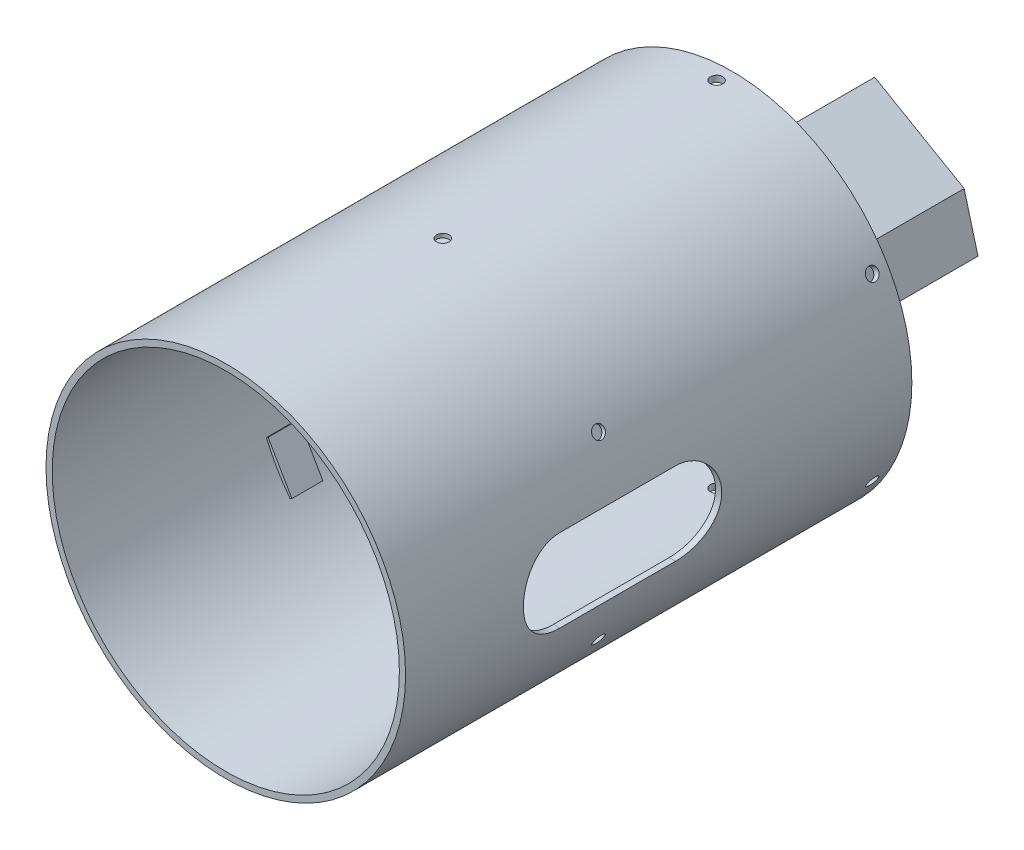
from build123d import *

# Parameters (mm, degrees)
SZKIC1_R                    = 87
SZKIC1_R_2                  = 84
DODANIE_WYCI_GNI_CIE1_DEPTH = 245
SZKIC3_R                    = 3
WYTNIJ_WYCI_GNI_CIE1_DEPTH  = 245
SZYK_KO_OWY1_COUNT          = 6
SZKIC5_W                    = 23.002883638
SZKIC5_H                    = 15
DODANIE_WYCI_GNI_CIE2_DEPTH = 85
SZYK_KO_OWY2_COUNT          = 6
WYTNIJ_WYCI_GNI_CIE2_DEPTH  = 245
WYTNIJ_WYCI_GNI_CIE3_DEPTH  = 130
DODANIE_WYCI_GNI_CIE3_DEPTH = 69


with BuildPart() as part:
    # Szkic1 → Dodanie-wyciągnięcie1 (new body)
    with BuildSketch(Plane.XY):
        Circle(SZKIC1_R)
        Circle(SZKIC1_R_2, mode=Mode.SUBTRACT)
    extrude(amount=DODANIE_WYCI_GNI_CIE1_DEPTH)

    # Szkic3 → Wytnij-wyciągnięcie1 (cut)
    with BuildSketch(Plane(origin=(0, 0, 0), x_dir=(1, 0, 0), z_dir=(0, 1, 0))):
        with Locations(Location((0, -140, 0), (0, 0, 270))):
            Circle(SZKIC3_R)
        with Locations(Location((0, -7.5, 0), (0, 0, 270))):
            Circle(SZKIC3_R)
    wytnij_wyci_gni_cie1 = extrude(amount=-WYTNIJ_WYCI_GNI_CIE1_DEPTH, mode=Mode.SUBTRACT)

    # Szyk kołowy1: Wytnij-wyciągnięcie1 ×6 about axis
    szyk_ko_owy1_axis = Axis((0, 0, 0), (0, 0, 1))
    for i in range(1, SZYK_KO_OWY1_COUNT):
        add(wytnij_wyci_gni_cie1.rotate(szyk_ko_owy1_axis, i * 360 / SZYK_KO_OWY1_COUNT), mode=Mode.SUBTRACT)

    # Szkic5 → Dodanie-wyciągnięcie2 (add)
    with BuildSketch(Plane(origin=(0, 0, 0), x_dir=(1, 0, 0), z_dir=(0, 1, 0))):
        with Locations((0, -140)):
            Rectangle(SZKIC5_W, SZKIC5_H)
    dodanie_wyci_gni_cie2 = extrude(amount=DODANIE_WYCI_GNI_CIE2_DEPTH)

    # Szyk kołowy2: Dodanie-wyciągnięcie2 ×6 about axis
    szyk_ko_owy2_axis = Axis((0, 0, 0), (0, 0, 1))
    for i in range(1, SZYK_KO_OWY2_COUNT):
        add(dodanie_wyci_gni_cie2.rotate(szyk_ko_owy2_axis, i * 360 / SZYK_KO_OWY2_COUNT))

    # Szkic6 → Wytnij-wyciągnięcie2 (cut)
    with BuildSketch(Plane(origin=(0, 0, 0), x_dir=(-1, 0, 0), z_dir=(0, 0, -1))):
        Polygon((-12.5, 82.3), (12.5, 82.3), (65.023890731, 51.975317547), (77.523890731, 30.324682453), (77.523890731, -30.324682453), (65.023890731, -51.975317547), (12.5, -82.3), (-12.5, -82.3), (-65.023890731, -51.975317547), (-77.523890731, -30.324682453), (-77.523890731, 30.324682453), (-65.023890731, 51.975317547), align=None)
    extrude(amount=-WYTNIJ_WYCI_GNI_CIE2_DEPTH, mode=Mode.SUBTRACT)

    # Szkic7 → Wytnij-wyciągnięcie3 (cut)
    with BuildSketch(Plane(origin=(0, 0, 0), x_dir=(0, 0, -1), z_dir=(1, 0, 0))):
        with BuildLine():
            Line((-168, -20), (-112, -20))
            ThreePointArc((-112, -20), (-92, 0), (-112, 20))
            Line((-112, 20), (-168, 20))
            ThreePointArc((-168, 20), (-188, 0), (-168, -20))
        make_face()
    extrude(amount=WYTNIJ_WYCI_GNI_CIE3_DEPTH, mode=Mode.SUBTRACT)


with BuildPart() as body_2:
    # Szkic8 → Dodanie-wyciągnięcie3 (new body)
    with BuildSketch(Plane(origin=(0, 0, 0), x_dir=(-1, 0, 0), z_dir=(0, 0, -1))):
        Polygon((0, 0), (-50, 0), (-43.301270189, 25), (0, 50), align=None)
    extrude(amount=DODANIE_WYCI_GNI_CIE3_DEPTH)


solid = Compound([part.part, body_2.part])
